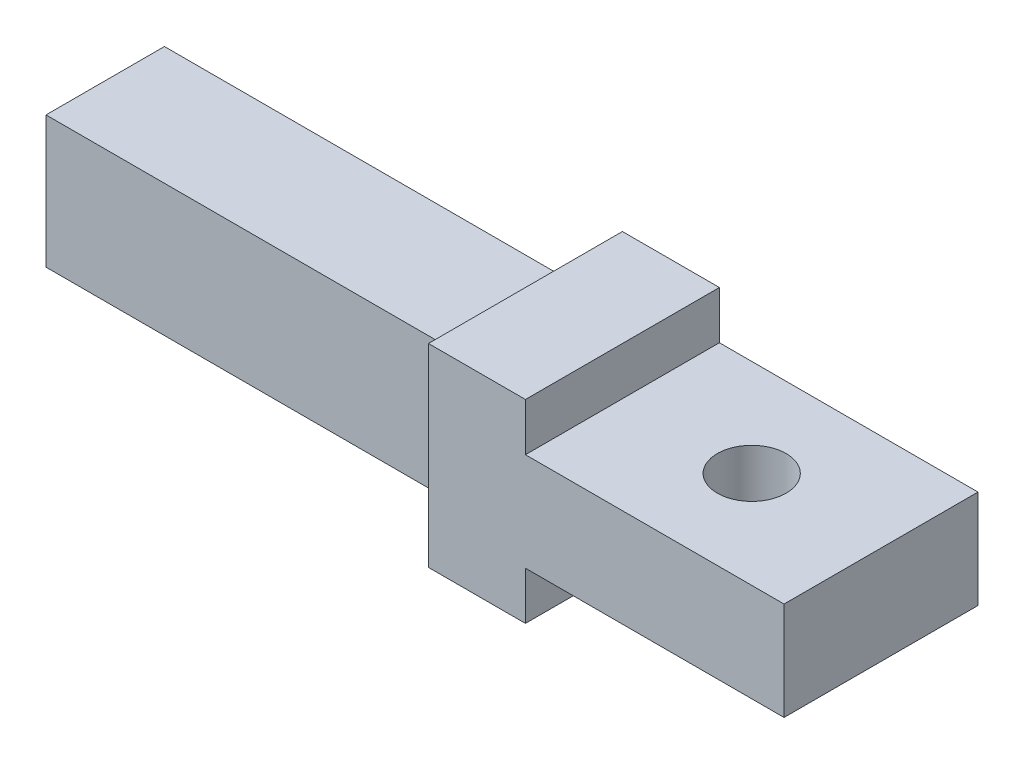
from build123d import *

# Parameters (mm, degrees)
SKETCH1_W               = 19.05
SKETCH1_H               = 19.05
BOSS_EXTRUDE1_DEPTH     = 76.2
SKETCH2_W               = 25.4
SKETCH2_H               = 4.699
CUT_EXTRUDE1_DEPTH      = 81.82230509
SKETCH3_W               = 41.275
SKETCH3_H               = 3.048
CUT_EXTRUDE2_DEPTH      = 81.82230509
SKETCH4_W               = 41.275
SKETCH4_H               = 3.7084
CUT_EXTRUDE3_DEPTH      = 81.158633372
F_1_4_CLEARANCE_HOLE1_D = 6.7564


with BuildPart() as part:
    # Sketch1 → Boss-Extrude1 (new body)
    with BuildSketch(Plane(origin=(0, 0, 0), x_dir=(0, 0, -1), z_dir=(1, 0, 0))):
        with Locations((9.525, 9.525)):
            Rectangle(SKETCH1_W, SKETCH1_H)
    extrude(amount=BOSS_EXTRUDE1_DEPTH)

    # Sketch2 → Cut-Extrude1 (cut, through all)
    with BuildSketch(Plane.XY):
        with Locations((63.5, 16.7005)):
            Rectangle(SKETCH2_W, SKETCH2_H)
        with Locations((63.5, 2.3495)):
            Rectangle(SKETCH2_W, SKETCH2_H)
    extrude(amount=-CUT_EXTRUDE1_DEPTH, mode=Mode.SUBTRACT)

    # Sketch3 → Cut-Extrude2 (cut, through all)
    with BuildSketch(Plane.XY):
        with Locations((20.6375, 17.526)):
            Rectangle(SKETCH3_W, SKETCH3_H)
        with Locations((20.6375, 1.524)):
            Rectangle(SKETCH3_W, SKETCH3_H)
    extrude(amount=-CUT_EXTRUDE2_DEPTH, mode=Mode.SUBTRACT)

    # Sketch4 → Cut-Extrude3 (cut, through all)
    with BuildSketch(Plane(origin=(0, 16.002, 0), x_dir=(1, 0, 0), z_dir=(0, 1, 0))):
        with Locations((20.6375, 17.1958)):
            Rectangle(SKETCH4_W, SKETCH4_H)
        with Locations((20.6375, 1.8542)):
            Rectangle(SKETCH4_W, SKETCH4_H)
    extrude(amount=-CUT_EXTRUDE3_DEPTH, mode=Mode.SUBTRACT)

    # 1/4 Clearance Hole1 (through all)
    with Locations(Plane(origin=(0, 14.351, 0), x_dir=(1, 0, 0), z_dir=(0, 1, 0))):
        with Locations((63.5, 9.525)):
            Hole(F_1_4_CLEARANCE_HOLE1_D / 2)


solid = part.part
